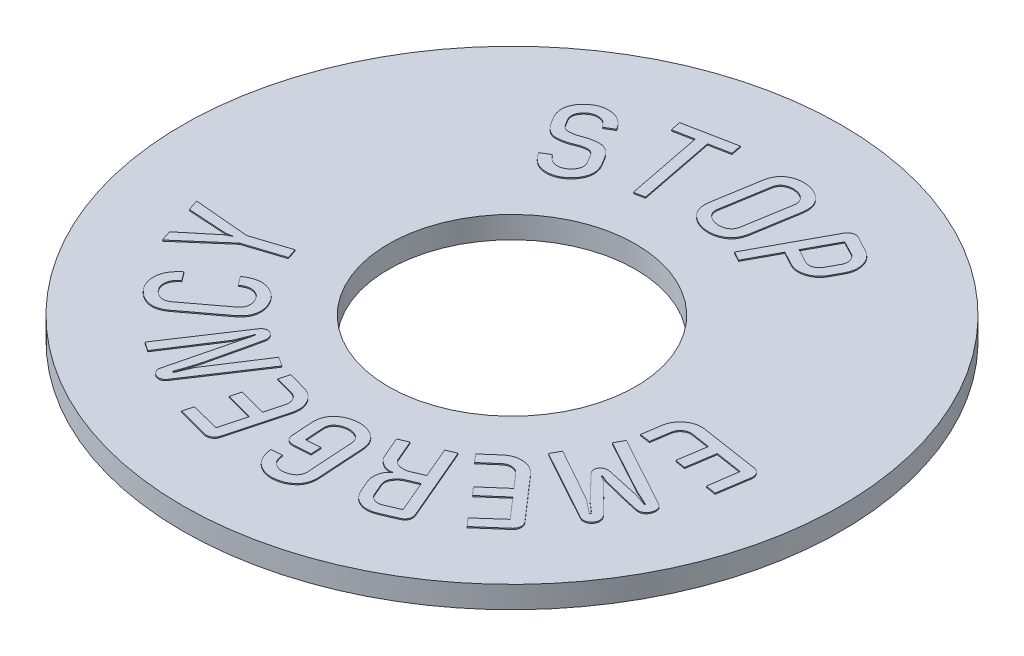
from build123d import *

# Parameters (mm, degrees)
SKETCH1_R           = 30
SKETCH1_R_2         = 11.25
BOSS_EXTRUDE1_DEPTH = 2
BOSS_EXTRUDE2_DEPTH = 0.1


with BuildPart() as part:
    # Sketch1 → Boss-Extrude1 (new body)
    with BuildSketch(Plane(origin=(0, 0, 0), x_dir=(1, 0, 0), z_dir=(0, 1, 0))):
        with Locations(Location((0, 0, 0), (0, 0, 270))):
            Circle(SKETCH1_R)
        with Locations(Location((0, 0, 0), (0, 0, 270))):
            Circle(SKETCH1_R_2, mode=Mode.SUBTRACT)
    extrude(amount=BOSS_EXTRUDE1_DEPTH)

    # Sketch3 → Boss-Extrude2 (add)
    # profile 1 of 13: a face of its own
    with BuildSketch(Plane(origin=(0, 2, 0), x_dir=(1, 0, 0), z_dir=(0, 1, 0))):
        with BuildLine():
            Line((23.360742002, -4.868812071), (23.80046509, -1.993762799))
            add(Edge.make_bspline(
                [(23.80046509, -1.993762799), (23.804162026, -1.944481383), (23.811490401, -1.846791638), (23.792650384, -1.70081306), (23.746172095, -1.561351396), (23.67556038, -1.430782013), (23.583336759, -1.312372436), (23.464878992, -1.219381231), (23.326899444, -1.149616805), (23.225419841, -1.125672964), (23.172736928, -1.113242571)],
                knots=[0, 0, 0, 0, 0.989267452, 1.961008668, 2.928604322, 3.92150966, 4.926237213, 5.915212748, 6.917687265, 8, 8, 8, 8], degree=3))
            Line((23.172736928, -1.113242571), (17.812657062, -0.292564763))
            add(Edge.make_bspline(
                [(17.812657062, -0.292564763), (17.74680703, -0.285968317), (17.618071331, -0.273072376), (17.426129639, -0.275816845), (17.240114892, -0.293056785), (17.05898389, -0.331111034), (16.882688347, -0.384661118), (16.710490848, -0.455187383), (16.544269486, -0.544920569), (16.384627892, -0.650051026), (16.233815464, -0.767333985), (16.099700271, -0.899956535), (15.977758132, -1.039965005), (15.874118393, -1.192905047), (15.781717051, -1.353846959), (15.709582815, -1.52810034), (15.647132108, -1.710703945), (15.621194621, -1.838270812), (15.60805247, -1.902907105)],
                knots=[0, 0, 0, 0, 1.051572874, 2.055807176, 3.047060603, 4.017826304, 4.993298972, 5.973576854, 6.971500116, 7.99192178, 9.010639383, 10.003564469, 10.986738304, 11.957951334, 12.936778027, 13.932125999, 14.952238045, 16, 16, 16, 16], degree=3))
            Line((15.60805247, -1.902907105), (15.342676304, -3.642492703))
            Line((15.342676304, -3.642492703), (16.293389808, -3.787899142))
            Line((16.293389808, -3.787899142), (16.559676299, -2.046833448))
            add(Edge.make_bspline(
                [(16.559676299, -2.046833448), (16.574236207, -1.983004134), (16.602781722, -1.857863187), (16.686582999, -1.685481977), (16.803472812, -1.537480158), (16.946124353, -1.413368765), (17.109376068, -1.317880454), (17.287149912, -1.257002908), (17.47507619, -1.227994323), (17.602024093, -1.238597816), (17.666880598, -1.244015042)],
                knots=[0, 0, 0, 0, 1.035449285, 2.030056384, 3.008390287, 4.006896508, 5.011359801, 5.986438677, 6.971290214, 8, 8, 8, 8], degree=3))
            Line((17.666880598, -1.244015042), (19.385407558, -1.506060989))
            Line((19.385407558, -1.506060989), (18.991233475, -4.083296392))
            Line((18.991233475, -4.083296392), (19.94194698, -4.228702832))
            Line((19.94194698, -4.228702832), (20.336121062, -1.651467429))
            Line((20.336121062, -1.651467429), (22.798812669, -2.028122663))
            Line((22.798812669, -2.028122663), (22.410028498, -4.723405631))
            Line((22.410028498, -4.723405631), (23.360742002, -4.868812071))
        make_face()
    # profile 2 of 13: a face of its own
    with BuildSketch(Plane(origin=(0, 2, 0), x_dir=(1, 0, 0), z_dir=(0, 1, 0))):
        with BuildLine():
            Line((17.349501254, -9.041782518), (16.829160357, -8.689619288))
            Line((16.829160357, -8.689619288), (16.862649191, -8.628702815))
            Line((16.862649191, -8.628702815), (17.418499319, -8.868175645))
            add(Edge.make_bspline(
                [(17.418499319, -8.868175645), (17.71964943, -8.943750905), (18.32159631, -9.094812752), (19.227364733, -9.32652173), (20.147753434, -9.549676012), (20.770885431, -9.681180668), (21.086436921, -9.747774087)],
                knots=[0, 0, 0, 0, 0.987684697, 1.974210543, 2.974148519, 4, 4, 4, 4], degree=3))
            add(Edge.make_bspline(
                [(21.086436921, -9.747774087), (21.128285633, -9.753042805), (21.209642242, -9.763285536), (21.331329867, -9.755667062), (21.448409785, -9.731199908), (21.558510568, -9.684814424), (21.660302295, -9.625286729), (21.750258337, -9.552458154), (21.8273051, -9.467552116), (21.867537779, -9.403077104), (21.887837447, -9.370545806)],
                knots=[0, 0, 0, 0, 1.069945797, 2.080043977, 3.08302623, 4.095916945, 5.102012342, 6.071443231, 7.026933797, 8, 8, 8, 8], degree=3))
            add(Edge.make_bspline(
                [(21.887837447, -9.370545806), (21.910013448, -9.327012592), (21.953909074, -9.240842066), (21.993259918, -9.100984742), (22.014006524, -8.956598995), (22.012958382, -8.809348802), (21.98607881, -8.663167762), (21.914187781, -8.531453982), (21.80926514, -8.413721034), (21.717994719, -8.355209325), (21.669883329, -8.32436604)],
                knots=[0, 0, 0, 0, 0.976803754, 1.93350518, 2.89471737, 3.891343824, 4.875181934, 5.836850555, 6.85973874, 8, 8, 8, 8], degree=3))
            Line((21.669883329, -8.32436604), (15.173174048, -4.751595078))
            Line((15.173174048, -4.751595078), (14.715493322, -5.584120212))
            Line((14.715493322, -5.584120212), (19.660890593, -8.27641024))
            Line((19.660890593, -8.27641024), (21.077173216, -8.922800068))
            Line((21.077173216, -8.922800068), (21.03810291, -8.993869287))
            Line((21.03810291, -8.993869287), (19.89190362, -8.601727063))
            Line((19.89190362, -8.601727063), (16.734602784, -7.923693611))
            add(Edge.make_bspline(
                [(16.734602784, -7.923693611), (16.696990086, -7.923776633), (16.624024541, -7.923937689), (16.516863579, -7.931896158), (16.417787871, -7.958827437), (16.325444043, -7.992785867), (16.243589778, -8.038384343), (16.171843022, -8.090475903), (16.111898952, -8.150617657), (16.082748913, -8.19746087), (16.068462501, -8.220418692)],
                knots=[0, 0, 0, 0, 1.178696214, 2.286573858, 3.352294177, 4.382929013, 5.362334893, 6.276182527, 7.155158415, 8, 8, 8, 8], degree=3))
            add(Edge.make_bspline(
                [(16.068462501, -8.220418692), (16.054025835, -8.250195334), (16.025425882, -8.309184753), (16.000784636, -8.404098475), (15.990409342, -8.501300508), (15.995532195, -8.599744672), (16.015788356, -8.696853226), (16.049930849, -8.790656057), (16.097980611, -8.880366868), (16.141821401, -8.933084404), (16.164026999, -8.959786122)],
                knots=[0, 0, 0, 0, 0.998124265, 1.977347596, 2.945436369, 3.943274761, 4.943683067, 5.932185595, 6.95264076, 8, 8, 8, 8], degree=3))
            add(Edge.make_bspline(
                [(16.164026999, -8.959786122), (16.33920729, -9.144496817), (16.699876076, -9.524787211), (17.253742939, -10.097094552), (17.815988096, -10.674485867), (18.185251154, -11.063498752), (18.367040159, -11.25501064)],
                knots=[0, 0, 0, 0, 0.960206654, 1.976915122, 3.004030925, 4, 4, 4, 4], degree=3))
            Line((18.367040159, -11.25501064), (19.33575387, -12.090456673))
            Line((19.33575387, -12.090456673), (19.263194731, -12.222442364))
            Line((19.263194731, -12.222442364), (17.980336965, -11.213104573))
            Line((17.980336965, -11.213104573), (13.25574922, -8.576098789))
            Line((13.25574922, -8.576098789), (13.108029311, -8.508110923))
            Line((13.108029311, -8.508110923), (12.650348585, -9.340636057))
            Line((12.650348585, -9.340636057), (19.168411214, -12.923941249))
            add(Edge.make_bspline(
                [(19.168411214, -12.923941249), (19.221331348, -12.946296577), (19.322860138, -12.989185911), (19.480666722, -13.011422102), (19.630427512, -13.00516519), (19.76790632, -12.960462796), (19.893292851, -12.896235764), (20.001089536, -12.811731812), (20.097004883, -12.716593621), (20.142910593, -12.63988088), (20.165999916, -12.60129646)],
                knots=[0, 0, 0, 0, 1.182308989, 2.268293556, 3.263025239, 4.252919619, 5.229046429, 6.159792407, 7.074425671, 8, 8, 8, 8], degree=3))
            add(Edge.make_bspline(
                [(20.165999916, -12.60129646), (20.181580701, -12.56929926), (20.212684314, -12.505423885), (20.240800085, -12.401030684), (20.254449178, -12.291548053), (20.251019382, -12.177265562), (20.229096467, -12.060510836), (20.186612865, -11.944543439), (20.123701945, -11.829928178), (20.067688313, -11.760519039), (20.038580586, -11.724450278)],
                knots=[0, 0, 0, 0, 0.902618981, 1.801880409, 2.731899368, 3.697973502, 4.695070111, 5.737260236, 6.824157418, 8, 8, 8, 8], degree=3))
            add(Edge.make_bspline(
                [(20.038580586, -11.724450278), (19.800582, -11.472921164), (19.317855049, -10.96275056), (18.820415696, -10.466912478), (18.568228575, -10.215537155)],
                knots=[0, 0, 0, 0, 0.986058829, 2, 2, 2, 2], degree=3))
            add(Edge.make_bspline(
                [(18.568228575, -10.215537155), (18.364608172, -10.017325587), (17.960454832, -9.623907906), (17.552019608, -9.234937515), (17.349501254, -9.041782518)],
                knots=[0, 0, 0, 0, 1.007639347, 2, 2, 2, 2], degree=3))
        make_face()
    # profile 3 of 13: a face of its own
    with BuildSketch(Plane(origin=(0, 2, 0), x_dir=(1, 0, 0), z_dir=(0, 1, 0))):
        with BuildLine():
            Line((14.699225393, -18.796223429), (16.890443621, -16.884455388))
            add(Edge.make_bspline(
                [(16.890443621, -16.884455388), (16.926072174, -16.849886151), (16.996441482, -16.78160908), (17.072713292, -16.655628631), (17.129957912, -16.520425177), (17.159085528, -16.37464262), (17.163995389, -16.224887849), (17.135043015, -16.077028089), (17.072287926, -15.935401264), (17.010832582, -15.851245822), (16.978954735, -15.807593079)],
                knots=[0, 0, 0, 0, 0.991620884, 1.958532373, 2.92829688, 3.923875178, 4.921469585, 5.914838079, 6.918393945, 8, 8, 8, 8], degree=3))
            Line((16.978954735, -15.807593079), (13.415699619, -11.721077803))
            add(Edge.make_bspline(
                [(13.415699619, -11.721077803), (13.369776335, -11.674038137), (13.279738393, -11.581811398), (13.131778361, -11.460239757), (12.977759946, -11.354354877), (12.815753064, -11.264359072), (12.645549891, -11.193034029), (12.469383947, -11.134572087), (12.284684868, -11.097221911), (12.095267621, -11.072910434), (11.903827666, -11.068744071), (11.715134768, -11.07955194), (11.532128827, -11.110142358), (11.353595304, -11.157747564), (11.179551773, -11.22244504), (11.011442071, -11.307821491), (10.847126714, -11.407973789), (10.745252733, -11.488216776), (10.693493292, -11.52898609)],
                knots=[0, 0, 0, 0, 1.045444074, 2.049714783, 3.041305798, 4.016491126, 4.992689633, 5.974180104, 6.964853515, 7.986263119, 9.009297387, 10.007248387, 10.989705289, 11.956092507, 12.943847875, 13.938107084, 14.952407429, 16, 16, 16, 16], degree=3))
            Line((10.693493292, -11.52898609), (9.367601376, -12.685256261))
            Line((9.367601376, -12.685256261), (9.999779652, -13.409842368))
            Line((9.999779652, -13.409842368), (11.326732523, -12.252118296))
            add(Edge.make_bspline(
                [(11.326732523, -12.252118296), (11.379161989, -12.212790255), (11.481991917, -12.135656156), (11.657573162, -12.060351667), (11.841520258, -12.01998719), (12.029958233, -12.020112578), (12.216069229, -12.050718001), (12.391540326, -12.117258177), (12.553247391, -12.217904333), (12.643839608, -12.307778197), (12.690288325, -12.353858597)],
                knots=[0, 0, 0, 0, 1.036709816, 2.033299272, 3.003670714, 4.005609757, 5.004090576, 5.980599581, 6.964606886, 8, 8, 8, 8], degree=3))
            Line((12.690288325, -12.353858597), (13.833604373, -13.662749044))
            Line((13.833604373, -13.662749044), (11.869364926, -15.376485335))
            Line((11.869364926, -15.376485335), (12.501543203, -16.101071442))
            Line((12.501543203, -16.101071442), (14.465782649, -14.387335151))
            Line((14.465782649, -14.387335151), (16.103352883, -16.264275067))
            Line((16.103352883, -16.264275067), (14.067047117, -18.071637322))
            Line((14.067047117, -18.071637322), (14.699225393, -18.796223429))
        make_face()
    # profile 4 of 13: a face of its own
    with BuildSketch(Plane(origin=(0, 2, 0), x_dir=(1, 0, 0), z_dir=(0, 1, 0))):
        with BuildLine():
            Line((11.405610111, -20.191861456), (8.519486307, -13.424649699))
            Line((8.519486307, -13.424649699), (7.65626717, -13.792800924))
            Line((7.65626717, -13.792800924), (8.85616746, -16.606255891))
            Line((8.85616746, -16.606255891), (7.769150768, -17.06985373))
            add(Edge.make_bspline(
                [(7.769150768, -17.06985373), (7.702445925, -17.093271725), (7.569537688, -17.139931672), (7.357400817, -17.169171352), (7.138942678, -17.164487374), (6.918617668, -17.131155234), (6.709201226, -17.063639444), (6.526204119, -16.958204405), (6.375843701, -16.815298356), (6.307595001, -16.697084204), (6.272882324, -16.636958081)],
                knots=[0, 0, 0, 0, 0.995015691, 1.982551438, 2.999373356, 4.068370397, 5.11514286, 6.082983089, 7.024966211, 8, 8, 8, 8], degree=3))
            Line((6.272882324, -16.636958081), (5.460919734, -14.729086757))
            Line((5.460919734, -14.729086757), (4.58704357, -15.101783059))
            Line((4.58704357, -15.101783059), (5.400612327, -17.009390782))
            add(Edge.make_bspline(
                [(5.400612327, -17.009390782), (5.433181602, -17.07439964), (5.500398652, -17.208566076), (5.649234053, -17.389808682), (5.835272497, -17.559453643), (6.014240071, -17.69060637), (6.17321894, -17.783995645), (6.300142591, -17.839086062), (6.429562681, -17.882011202), (6.563063443, -17.908209741), (6.700077923, -17.922451645), (6.840481343, -17.919649839), (6.984457288, -17.90554458), (7.07949585, -17.883715603), (7.127933094, -17.872590272)],
                knots=[0, 0, 0, 0, 1.248757034, 2.577206985, 4.007098047, 5.577644763, 6.38804345, 7.176493922, 7.955493042, 8.731097296, 9.51430453, 10.322644041, 11.145120702, 12, 12, 12, 12], degree=3))
            add(Edge.make_bspline(
                [(7.127933094, -17.872590272), (7.088176117, -17.89797136), (7.010263089, -17.947711496), (6.905254569, -18.036896178), (6.811637228, -18.133213297), (6.730362332, -18.23851891), (6.660740938, -18.351047095), (6.605812051, -18.473858548), (6.559876782, -18.603666489), (6.520278263, -18.784724545), (6.48939876, -19.005346999), (6.485703199, -19.256884674), (6.510008488, -19.487266706), (6.558166561, -19.626335843), (6.581371229, -19.693345441)],
                knots=[0, 0, 0, 0, 0.826063462, 1.618863188, 2.408751767, 3.17695492, 3.946531314, 4.722504653, 5.531187722, 6.355855609, 7.967305748, 9.427244191, 10.760333624, 12, 12, 12, 12], degree=3))
            Line((6.581371229, -19.693345441), (7.055175844, -20.800313972))
            add(Edge.make_bspline(
                [(7.055175844, -20.800313972), (7.08444337, -20.862794338), (7.141700026, -20.98502595), (7.24485018, -21.154514958), (7.357985221, -21.309476826), (7.483267186, -21.447686128), (7.619104569, -21.571763165), (7.76456457, -21.681042469), (7.922183646, -21.773967754), (8.089219236, -21.850287919), (8.26288659, -21.911498293), (8.441528198, -21.950721345), (8.622089018, -21.975004419), (8.805936312, -21.980427944), (8.992149783, -21.963930987), (9.181564253, -21.932691405), (9.372580948, -21.880049302), (9.498379387, -21.833058644), (9.562312932, -21.809176954)],
                knots=[0, 0, 0, 0, 1.095410878, 2.142974616, 3.146261397, 4.139440829, 5.100964843, 6.065149471, 7.024416431, 8.00167452, 8.978771279, 9.943691397, 10.901766133, 11.86986691, 12.858591887, 13.867167926, 14.916047628, 16, 16, 16, 16], degree=3))
            Line((9.562312932, -21.809176954), (11.012878468, -21.190655193))
            add(Edge.make_bspline(
                [(11.012878468, -21.190655193), (11.061888655, -21.1666916), (11.156009846, -21.120670924), (11.275979994, -21.024864837), (11.369067852, -20.911646612), (11.434189978, -20.783250195), (11.474064292, -20.64432676), (11.481726222, -20.496866646), (11.459393229, -20.343765296), (11.423470738, -20.244421631), (11.404863513, -20.192963342)],
                knots=[0, 0, 0, 0, 1.085606868, 2.084844364, 3.035395955, 3.987580068, 4.936889065, 5.897129465, 6.910749658, 8, 8, 8, 8], degree=3))
            Line((11.404863513, -20.192963342), (11.405610111, -20.191861456))
        make_face()
        with BuildLine():
            add(Edge.make_bspline(
                [(9.1862815, -20.924252455), (9.122848996, -20.946820911), (8.999902539, -20.990563655), (8.807980288, -21.012599516), (8.621783125, -20.994984697), (8.443534089, -20.942912125), (8.278924006, -20.857942589), (8.136256628, -20.740929378), (8.013174007, -20.598706303), (7.95662249, -20.485610395), (7.927657049, -20.427683161)],
                knots=[0, 0, 0, 0, 1.071983637, 2.077745371, 3.054122547, 4.039261738, 5.024723952, 5.988758296, 6.969850727, 8, 8, 8, 8], degree=3))
            Line((7.927657049, -20.427683161), (7.456364015, -19.319286926))
            add(Edge.make_bspline(
                [(7.456364015, -19.319286926), (7.436150979, -19.253452068), (7.396316377, -19.123708799), (7.397848418, -18.917896725), (7.441822503, -18.714084092), (7.534828004, -18.518908644), (7.656336618, -18.338337276), (7.800006315, -18.180231873), (7.962724101, -18.04944978), (8.084610267, -17.98633136), (8.145611167, -17.954742209)],
                knots=[0, 0, 0, 0, 0.983826069, 1.938863598, 2.916396067, 3.957823914, 5.021766433, 6.032883243, 7.015508515, 8, 8, 8, 8], degree=3))
            Line((8.145611167, -17.954742209), (9.233408839, -17.490789081))
            Line((9.233408839, -17.490789081), (10.465124667, -20.378843232))
            Line((10.465124667, -20.378843232), (9.1862815, -20.924252455))
        make_face(mode=Mode.SUBTRACT)
    # profile 5 of 13: a face of its own
    with BuildSketch(Plane(origin=(0, 2, 0), x_dir=(1, 0, 0), z_dir=(0, 1, 0))):
        with BuildLine():
            Line((1.818226219, -19.215805804), (0.500108088, -19.298678142))
            Line((0.500108088, -19.298678142), (0.390338587, -17.552749739))
            add(Edge.make_bspline(
                [(0.390338587, -17.552749739), (0.390595743, -17.513807691), (0.391095329, -17.438153777), (0.40726195, -17.327812891), (0.431946752, -17.22305529), (0.468225446, -17.123996866), (0.518116593, -17.033326823), (0.575546041, -16.947767186), (0.644544223, -16.868583923), (0.752304922, -16.773893936), (0.902501464, -16.67021331), (1.104493013, -16.581400351), (1.322316964, -16.515656496), (1.475351249, -16.501271273), (1.554074735, -16.493871265)],
                knots=[0, 0, 0, 0, 0.799187335, 1.552605829, 2.284997015, 3.007967986, 3.711720342, 4.405948712, 5.122049357, 5.861961628, 7.349161567, 8.84955465, 10.379356355, 12, 12, 12, 12], degree=3))
            add(Edge.make_bspline(
                [(1.554074735, -16.493871265), (1.633528677, -16.491994451), (1.788873542, -16.488324988), (2.016899089, -16.524194177), (2.230597236, -16.596401087), (2.397374502, -16.681111665), (2.52025905, -16.764320919), (2.601565953, -16.837465302), (2.671984039, -16.918307879), (2.73364561, -17.00663529), (2.784038627, -17.104076044), (2.821815396, -17.210370125), (2.851367748, -17.324221159), (2.861563583, -17.403528691), (2.866829153, -17.444486532)],
                knots=[0, 0, 0, 0, 1.58101885, 3.091138779, 4.569863131, 6.058696109, 6.8029877, 7.520482735, 8.230597278, 8.934751731, 9.661772023, 10.408474618, 11.178067438, 12, 12, 12, 12], degree=3))
            Line((2.866829153, -17.444486532), (3.13876097, -21.756222155))
            add(Edge.make_bspline(
                [(3.13876097, -21.756222155), (3.138225981, -21.796624227), (3.137184166, -21.875301533), (3.124108287, -21.990222444), (3.098868047, -22.097521156), (3.06331582, -22.19838974), (3.016321511, -22.29263373), (2.957562139, -22.379870106), (2.887262112, -22.459902579), (2.78071362, -22.557296838), (2.627684235, -22.658777899), (2.426288775, -22.751542281), (2.206913648, -22.815406863), (2.053547999, -22.831457568), (1.97489384, -22.839689233)],
                knots=[0, 0, 0, 0, 0.819105773, 1.595092334, 2.340085916, 3.049850285, 3.75943366, 4.469831141, 5.176694059, 5.914671909, 7.392062834, 8.877819893, 10.39877801, 12, 12, 12, 12], degree=3))
            add(Edge.make_bspline(
                [(1.97489384, -22.839689233), (1.896977959, -22.840539948), (1.743883898, -22.842211488), (1.518852653, -22.791223195), (1.308098393, -22.696442012), (1.144822953, -22.585494258), (1.025967762, -22.475741617), (0.944149891, -22.38153667), (0.876219211, -22.274213225), (0.814809158, -22.158123472), (0.765138667, -22.030235851), (0.725052461, -21.892210753), (0.694419343, -21.743641897), (0.683079659, -21.640507256), (0.677228554, -21.587291341)],
                knots=[0, 0, 0, 0, 1.386321899, 2.723933152, 4.076286709, 5.489307963, 6.22299165, 6.958299132, 7.707664743, 8.483551469, 9.298120133, 10.149907049, 11.045380017, 12, 12, 12, 12], degree=3))
            Line((0.677228554, -21.587291341), (-0.292513367, -21.64692419))
            add(Edge.make_bspline(
                [(-0.292513367, -21.64692419), (-0.282198344, -21.739069184), (-0.262207681, -21.91764751), (-0.205906711, -22.174172668), (-0.132175489, -22.411357151), (-0.042139179, -22.631034479), (0.067492177, -22.831387254), (0.193669357, -23.014176255), (0.338188271, -23.178275508), (0.501629044, -23.319355452), (0.674686771, -23.443237697), (0.853123696, -23.550717884), (1.037759617, -23.639147355), (1.227464789, -23.707055194), (1.421732961, -23.760255439), (1.621617822, -23.793864463), (1.827217168, -23.807076497), (1.965393002, -23.802617998), (2.035250365, -23.800363922)],
                knots=[0, 0, 0, 0, 1.25439028, 2.431026427, 3.548390851, 4.613282252, 5.639030896, 6.633708319, 7.614364075, 8.590017722, 9.549435708, 10.49261159, 11.406199913, 12.315550282, 13.21655549, 14.129391837, 15.054279248, 16, 16, 16, 16], degree=3))
            add(Edge.make_bspline(
                [(2.035250365, -23.800363922), (2.106332138, -23.794068919), (2.245792567, -23.781718301), (2.450813005, -23.746782574), (2.64693894, -23.6934842), (2.837075356, -23.62988917), (3.016706534, -23.546116764), (3.189130887, -23.450314199), (3.353654739, -23.339475274), (3.508872584, -23.21432574), (3.652582248, -23.076348568), (3.775866579, -22.920630229), (3.877935398, -22.750601755), (3.961292153, -22.567434042), (4.023365139, -22.36975185), (4.063893785, -22.157669638), (4.089077955, -21.932148019), (4.086842665, -21.777368821), (4.085695642, -21.69794497)],
                knots=[0, 0, 0, 0, 1.040060034, 2.040568389, 3.026643651, 4.000527954, 4.95930171, 5.91123233, 6.873805961, 7.8471449, 8.815013293, 9.771812088, 10.733074734, 11.699261578, 12.698973561, 13.745490792, 14.843114535, 16, 16, 16, 16], degree=3))
            Line((4.085695642, -21.69794497), (3.815728556, -17.383822199))
            add(Edge.make_bspline(
                [(3.815728556, -17.383822199), (3.806056297, -17.304321144), (3.787160992, -17.149011335), (3.734636938, -16.926368108), (3.66589167, -16.719467887), (3.57921398, -16.528440726), (3.470811873, -16.355370102), (3.346183705, -16.197666411), (3.202541873, -16.057283768), (3.040819604, -15.936308061), (2.868999631, -15.829395157), (2.689342641, -15.738722884), (2.503969033, -15.664871545), (2.313401418, -15.605983769), (2.116865675, -15.561240087), (1.913476797, -15.537657571), (1.705029333, -15.526595754), (1.564693536, -15.53209293), (1.49371821, -15.534873146)],
                knots=[0, 0, 0, 0, 1.155411881, 2.257162477, 3.295502504, 4.299034303, 5.277344073, 6.236166324, 7.194615157, 8.167588045, 9.145897814, 10.112831502, 11.068628266, 12.02299394, 12.989927628, 13.973578407, 14.975130116, 16, 16, 16, 16], degree=3))
            add(Edge.make_bspline(
                [(1.49371821, -15.534873146), (1.423132809, -15.540235839), (1.283962062, -15.550809273), (1.080364975, -15.589753775), (0.883775334, -15.638906656), (0.695310193, -15.704665965), (0.514747811, -15.785573879), (0.342131062, -15.881925348), (0.174815644, -15.990436615), (0.018477518, -16.115924104), (-0.126374876, -16.25367138), (-0.251915259, -16.407714067), (-0.355573733, -16.57615393), (-0.440783401, -16.757587159), (-0.503805648, -16.952639341), (-0.547498789, -17.161078267), (-0.571241508, -17.383007302), (-0.570513394, -17.535526694), (-0.570139628, -17.613820116)],
                knots=[0, 0, 0, 0, 1.035482593, 2.041624501, 3.029777764, 4.000022768, 4.959446084, 5.922524889, 6.891423792, 7.875232608, 8.853036292, 9.81259912, 10.775191329, 11.741427039, 12.740057205, 13.768567865, 14.85452954, 16, 16, 16, 16], degree=3))
            Line((-0.570139628, -17.613820116), (-0.445762356, -19.578701375))
            add(Edge.make_bspline(
                [(-0.445762356, -19.578701375), (-0.439429857, -19.630546266), (-0.427188939, -19.730764055), (-0.377435696, -19.870426111), (-0.304582889, -19.993232226), (-0.205342926, -20.093458654), (-0.089172673, -20.175835994), (0.045116068, -20.230345468), (0.193426874, -20.26217627), (0.296478734, -20.261485248), (0.350297377, -20.261124362)],
                knots=[0, 0, 0, 0, 1.06501534, 2.05870779, 3.007032648, 3.960436507, 4.920729162, 5.898865765, 6.902686528, 8, 8, 8, 8], degree=3))
            Line((0.350297377, -20.261124362), (1.877836147, -20.163925864))
            Line((1.877836147, -20.163925864), (1.818226219, -19.215805804))
        make_face()
    # profile 6 of 13: a face of its own
    with BuildSketch(Plane(origin=(0, 2, 0), x_dir=(1, 0, 0), z_dir=(0, 1, 0))):
        with BuildLine():
            Line((-7.397287467, -22.684494332), (-4.588402136, -23.436955054))
            add(Edge.make_bspline(
                [(-4.588402136, -23.436955054), (-4.539503785, -23.447040098), (-4.443369305, -23.466867359), (-4.296555334, -23.461580436), (-4.152523934, -23.433440336), (-4.015281651, -23.376163059), (-3.888284826, -23.296234285), (-3.78027519, -23.191061511), (-3.698614245, -23.059558148), (-3.663066375, -22.9617568), (-3.644707632, -22.911247168)],
                knots=[0, 0, 0, 0, 0.998041999, 1.962157123, 2.922682704, 3.927937283, 4.925918218, 5.916572105, 6.924011005, 8, 8, 8, 8], degree=3))
            Line((-3.644707632, -22.911247168), (-2.240765155, -17.673126318))
            add(Edge.make_bspline(
                [(-2.240765155, -17.673126318), (-2.227639647, -17.609207994), (-2.201734471, -17.483055503), (-2.18150134, -17.29302228), (-2.179533349, -17.105460511), (-2.196640013, -16.921362852), (-2.230203477, -16.739898929), (-2.282304539, -16.561770229), (-2.353595088, -16.387119342), (-2.440042949, -16.216855645), (-2.54187903, -16.055465643), (-2.65543115, -15.904804674), (-2.784144532, -15.771124295), (-2.922268496, -15.648659526), (-3.073473344, -15.541341121), (-3.237744881, -15.448719496), (-3.413546692, -15.369770897), (-3.537013584, -15.328744925), (-3.599440239, -15.308001597)],
                knots=[0, 0, 0, 0, 1.038325845, 2.049293275, 3.036854866, 4.019515377, 4.987936912, 5.970476597, 6.968323489, 7.986895657, 9.006322234, 10.002780058, 10.984473542, 11.955303124, 12.93780253, 13.929842157, 14.953298103, 16, 16, 16, 16], degree=3))
            Line((-3.599440239, -15.308001597), (-5.298791427, -14.850949585))
            Line((-5.298791427, -14.850949585), (-5.547613101, -15.779784176))
            Line((-5.547613101, -15.779784176), (-3.846614813, -16.235457602))
            add(Edge.make_bspline(
                [(-3.846614813, -16.235457602), (-3.785009145, -16.257727561), (-3.6642132, -16.301394335), (-3.502880816, -16.403706354), (-3.366883996, -16.534088399), (-3.26107291, -16.690180669), (-3.183229153, -16.862501785), (-3.140536468, -17.045847782), (-3.135298208, -17.236321011), (-3.15841499, -17.361490549), (-3.170238284, -17.42550968)],
                knots=[0, 0, 0, 0, 1.036327074, 2.032022574, 3.003446691, 4.003863017, 5.003494087, 5.985850586, 6.969844447, 8, 8, 8, 8], degree=3))
            Line((-3.170238284, -17.42550968), (-3.619277469, -19.102921376))
            Line((-3.619277469, -19.102921376), (-6.137202566, -18.428404792))
            Line((-6.137202566, -18.428404792), (-6.386024239, -19.357239384))
            Line((-6.386024239, -19.357239384), (-3.868099142, -20.031755968))
            Line((-3.868099142, -20.031755968), (-4.512637212, -22.437773283))
            Line((-4.512637212, -22.437773283), (-7.148465794, -21.75565974))
            Line((-7.148465794, -21.75565974), (-7.397287467, -22.684494332))
        make_face()
    # profile 7 of 13: a face of its own
    with BuildSketch(Plane(origin=(0, 2, 0), x_dir=(1, 0, 0), z_dir=(0, 1, 0))):
        with BuildLine():
            Line((-13.694153926, -19.451331185), (-10.6311356, -14.739098322))
            Line((-10.6311356, -14.739098322), (-10.067202242, -13.278095155))
            Line((-10.067202242, -13.278095155), (-10.009223042, -13.316466344))
            Line((-10.009223042, -13.316466344), (-11.740609163, -20.257859658))
            Line((-11.740609163, -20.257859658), (-11.737481967, -20.232138059))
            add(Edge.make_bspline(
                [(-11.737481967, -20.232138059), (-11.748255759, -20.267783724), (-11.769263848, -20.337290104), (-11.771299275, -20.447085724), (-11.752540971, -20.555714051), (-11.711980667, -20.662002648), (-11.654329046, -20.760570071), (-11.589606165, -20.852911803), (-11.512002959, -20.932028617), (-11.453386098, -20.97560645), (-11.424290806, -20.997236912)],
                knots=[0, 0, 0, 0, 1.003790086, 1.957315624, 2.939685071, 3.973694416, 5.016957811, 6.024626493, 7.01949596, 8, 8, 8, 8], degree=3))
            add(Edge.make_bspline(
                [(-11.424290806, -20.997236912), (-11.387633204, -21.019082189), (-11.31575282, -21.061917696), (-11.194951349, -21.096125325), (-11.070733826, -21.110381606), (-10.943308931, -21.099756094), (-10.816831615, -21.066289992), (-10.699914094, -20.998892714), (-10.592152982, -20.905745289), (-10.535227624, -20.825943899), (-10.505530371, -20.784312504)],
                knots=[0, 0, 0, 0, 0.966688811, 1.895540337, 2.828902563, 3.797844633, 4.787732983, 5.777784507, 6.840697765, 8, 8, 8, 8], degree=3))
            Line((-10.505530371, -20.784312504), (-6.386197545, -14.560884156))
            Line((-6.386197545, -14.560884156), (-7.207569557, -14.017292309))
            Line((-7.207569557, -14.017292309), (-10.251402288, -18.700535572))
            Line((-10.251402288, -18.700535572), (-10.806094863, -20.042593946))
            Line((-10.806094863, -20.042593946), (-10.941238859, -19.994841168))
            add(Edge.make_bspline(
                [(-10.941238859, -19.994841168), (-10.925193118, -19.94333275), (-10.888332763, -19.825007357), (-10.823937355, -19.627132415), (-10.738319402, -19.38817529), (-10.641387994, -19.116865493), (-10.540541646, -18.833064441), (-10.4474247, -18.55572492), (-10.368130904, -18.294723813), (-10.323933324, -18.124859353), (-10.302665385, -18.04312033)],
                knots=[0, 0, 0, 0, 0.630301841, 1.447932519, 2.43086737, 3.595620365, 4.813966911, 5.949550592, 7.013320786, 8, 8, 8, 8], degree=3))
            add(Edge.make_bspline(
                [(-10.302665385, -18.04312033), (-10.207929799, -17.629929987), (-10.018923268, -16.805575832), (-9.770956468, -15.780792009), (-9.574921579, -14.969534273), (-9.437775676, -14.372571992), (-9.307967794, -13.787013995), (-9.227558148, -13.399670876), (-9.187746244, -13.207892055)],
                knots=[0, 0, 0, 0, 1.537655605, 3.067769626, 3.824468825, 4.565035301, 5.289529553, 6, 6, 6, 6], degree=3))
            add(Edge.make_bspline(
                [(-9.187746244, -13.207892055), (-9.185243962, -13.172722972), (-9.180273918, -13.10286998), (-9.187456644, -12.997702996), (-9.216783591, -12.895771589), (-9.255999036, -12.796579025), (-9.30661803, -12.703547823), (-9.368680348, -12.623303682), (-9.432606367, -12.550793236), (-9.483225286, -12.513554492), (-9.50797114, -12.495349747)],
                knots=[0, 0, 0, 0, 1.03367766, 2.05309521, 3.070798676, 4.129888966, 5.178913687, 6.162254334, 7.101589169, 8, 8, 8, 8], degree=3))
            add(Edge.make_bspline(
                [(-9.50797114, -12.495349747), (-9.541869688, -12.474735797), (-9.608370817, -12.434295985), (-9.720638871, -12.401707789), (-9.836264466, -12.387640662), (-9.955477551, -12.39589367), (-10.074815636, -12.42911247), (-10.18816743, -12.494363173), (-10.294836166, -12.58773836), (-10.353837897, -12.666775138), (-10.384817321, -12.708274154)],
                knots=[0, 0, 0, 0, 0.938253505, 1.840636831, 2.749145332, 3.693571009, 4.659562116, 5.663537209, 6.773217845, 8, 8, 8, 8], degree=3))
            Line((-10.384817321, -12.708274154), (-14.496199538, -18.920529735))
            Line((-14.496199538, -18.920529735), (-13.694153926, -19.451331185))
        make_face()
    # profile 8 of 13: a face of its own
    with BuildSketch(Plane(origin=(0, 2, 0), x_dir=(1, 0, 0), z_dir=(0, 1, 0))):
        with BuildLine():
            add(Edge.make_bspline(
                [(-14.736563811, -10.180989003), (-14.693078611, -10.151147676), (-14.608527228, -10.093125052), (-14.476823841, -10.021388843), (-14.34712889, -9.961698359), (-14.218704181, -9.916409153), (-14.091802985, -9.885275124), (-13.966315408, -9.870567177), (-13.842506068, -9.867907262), (-13.682494497, -9.887184783), (-13.491634019, -9.934690484), (-13.282439557, -10.03351715), (-13.096083043, -10.169030866), (-12.997917605, -10.286032286), (-12.948180854, -10.345312524)],
                knots=[0, 0, 0, 0, 0.945101877, 1.837629111, 2.685202313, 3.502865876, 4.275768415, 5.02277245, 5.764379961, 6.490318181, 7.907261877, 9.269981263, 10.616801743, 12, 12, 12, 12], degree=3))
            add(Edge.make_bspline(
                [(-12.948180854, -10.345312524), (-12.904102268, -10.409438654), (-12.817997813, -10.534704592), (-12.727187944, -10.741549174), (-12.668577545, -10.955026031), (-12.650975868, -11.137912337), (-12.653848585, -11.283704415), (-12.671071474, -11.38950628), (-12.699941436, -11.491244108), (-12.74018242, -11.589613412), (-12.794771617, -11.683512911), (-12.860068598, -11.774288753), (-12.938042586, -11.860491166), (-12.996846933, -11.912883613), (-13.02697965, -11.939730724)],
                knots=[0, 0, 0, 0, 1.573970731, 3.074642434, 4.552706854, 6.043645665, 6.780156909, 7.502601233, 8.208885464, 8.919785686, 9.650263793, 10.40467, 11.182515738, 12, 12, 12, 12], degree=3))
            Line((-13.02697965, -11.939730724), (-16.47218229, -14.526801241))
            add(Edge.make_bspline(
                [(-16.47218229, -14.526801241), (-16.539334304, -14.569168011), (-16.667552957, -14.650062238), (-16.881895933, -14.715976855), (-17.097876055, -14.728685478), (-17.311122596, -14.685166049), (-17.514162143, -14.602350452), (-17.704935225, -14.487031771), (-17.877729298, -14.337369265), (-17.976167944, -14.218583082), (-18.026511799, -14.157833015)],
                knots=[0, 0, 0, 0, 1.065410529, 2.034272625, 2.984004733, 3.949323503, 4.938778606, 5.924879273, 6.938734129, 8, 8, 8, 8], degree=3))
            add(Edge.make_bspline(
                [(-18.026511799, -14.157833015), (-18.069534906, -14.093389848), (-18.154705351, -13.965815308), (-18.23292172, -13.749121789), (-18.269111157, -13.520428922), (-18.261240046, -13.323780231), (-18.233604863, -13.164033216), (-18.196007174, -13.045010688), (-18.145235233, -12.927950155), (-18.079658054, -12.813636409), (-17.997891163, -12.703001012), (-17.904089725, -12.593934746), (-17.795866661, -12.48735159), (-17.71576922, -12.42140767), (-17.67443207, -12.38737495)],
                knots=[0, 0, 0, 0, 1.377157514, 2.726281873, 4.067733145, 5.483309839, 6.212221035, 6.952750155, 7.702338071, 8.483312732, 9.296354982, 10.151115411, 11.045816953, 12, 12, 12, 12], degree=3))
            Line((-17.67443207, -12.38737495), (-18.265003901, -11.59873535))
            add(Edge.make_bspline(
                [(-18.265003901, -11.59873535), (-18.336409297, -11.659198394), (-18.474814013, -11.776393604), (-18.658347456, -11.967758288), (-18.816738142, -12.162225051), (-18.950166282, -12.360714625), (-19.059237459, -12.563557645), (-19.141804613, -12.771623833), (-19.197563762, -12.984536655), (-19.22708665, -13.199576597), (-19.23503511, -13.412935699), (-19.224699124, -13.622070456), (-19.198581835, -13.825364631), (-19.153084517, -14.022456052), (-19.088910223, -14.213328442), (-19.006132652, -14.397509614), (-18.907793429, -14.576990669), (-18.827974379, -14.688388869), (-18.787674641, -14.744632563)],
                knots=[0, 0, 0, 0, 1.260765719, 2.443735782, 3.568702851, 4.638655124, 5.663372736, 6.66797587, 7.649367216, 8.623296728, 9.588472362, 10.52386682, 11.443500147, 12.348227671, 13.246500308, 14.153828214, 15.067888705, 16, 16, 16, 16], degree=3))
            add(Edge.make_bspline(
                [(-18.787674641, -14.744632563), (-18.743975579, -14.800826613), (-18.658024235, -14.911354252), (-18.513409474, -15.060107834), (-18.364671379, -15.197305386), (-18.206251307, -15.318189344), (-18.040244847, -15.424768927), (-17.864261942, -15.513316066), (-17.681715364, -15.588856447), (-17.492693256, -15.650023579), (-17.298360517, -15.690670908), (-17.100773824, -15.707911189), (-16.901847953, -15.699439953), (-16.702324585, -15.664748278), (-16.502214754, -15.60744791), (-16.301206403, -15.525781059), (-16.098886146, -15.419836048), (-15.969131469, -15.332715391), (-15.902297435, -15.287841287)],
                knots=[0, 0, 0, 0, 1.036436485, 2.038558857, 3.018468549, 3.982621174, 4.938138908, 5.888612461, 6.848837207, 7.814535914, 8.77910107, 9.735277794, 10.696985993, 11.671535571, 12.679299101, 13.724145979, 14.827753213, 16, 16, 16, 16], degree=3))
            Line((-15.902297435, -15.287841287), (-12.45501873, -12.698635763))
            add(Edge.make_bspline(
                [(-12.45501873, -12.698635763), (-12.393689869, -12.647451077), (-12.274056569, -12.547605871), (-12.11672894, -12.382323408), (-11.980924753, -12.212463273), (-11.868924296, -12.03586852), (-11.783232097, -11.851846683), (-11.720492286, -11.662836288), (-11.681378708, -11.468022217), (-11.66733744, -11.269303056), (-11.673016306, -11.069592258), (-11.694404369, -10.872105314), (-11.733296203, -10.678012547), (-11.788998031, -10.4879436), (-11.860772877, -10.301413616), (-11.951656222, -10.119891794), (-12.053826952, -9.939086472), (-12.136658221, -9.825921661), (-12.178635161, -9.768572396)],
                knots=[0, 0, 0, 0, 1.160560654, 2.263888428, 3.310754723, 4.318420197, 5.296193925, 6.254566738, 7.207447595, 8.177085497, 9.144269306, 10.108821689, 11.061702547, 12.018179194, 12.985363002, 13.962832859, 14.967611598, 16, 16, 16, 16], degree=3))
            add(Edge.make_bspline(
                [(-12.178635161, -9.768572396), (-12.221250327, -9.714652104), (-12.305786805, -9.607689443), (-12.448849665, -9.462954612), (-12.604548508, -9.336444829), (-12.767202319, -9.219570561), (-12.944807747, -9.124112787), (-13.13098415, -9.038470117), (-13.329821655, -8.972631346), (-13.53678016, -8.920074452), (-13.751178081, -8.886817756), (-13.970246147, -8.882645651), (-14.191707562, -8.903204234), (-14.415706653, -8.948428086), (-14.641489289, -9.022275091), (-14.870512735, -9.120120615), (-15.102128524, -9.244340467), (-15.252002002, -9.343706829), (-15.328910448, -9.394697256)],
                knots=[0, 0, 0, 0, 0.930912967, 1.846668936, 2.750414574, 3.647567508, 4.556029005, 5.478026992, 6.421638082, 7.389642577, 8.369659997, 9.354464853, 10.35073478, 11.378543869, 12.444351051, 13.564088745, 14.749997983, 16, 16, 16, 16], degree=3))
            Line((-15.328910448, -9.394697256), (-14.736563811, -10.180989003))
        make_face()
    # profile 9 of 13: a face of its own
    with BuildSketch(Plane(origin=(0, 2, 0), x_dir=(1, 0, 0), z_dir=(0, 1, 0))):
        with BuildLine():
            Line((-23.25866655, -5.446166638), (-22.936401608, -6.437864423))
            add(Edge.make_bspline(
                [(-22.936401608, -6.437864423), (-22.885089052, -6.442557998), (-22.776317951, -6.452507324), (-22.603529853, -6.462910297), (-22.412498032, -6.47714125), (-22.202907873, -6.490363104), (-21.975384994, -6.503189597), (-21.729565103, -6.519011864), (-21.465763307, -6.533781373), (-21.189664046, -6.548426541), (-20.913009645, -6.56313882), (-20.647531349, -6.577899981), (-20.398917357, -6.593732637), (-20.167470239, -6.606361531), (-19.953501983, -6.620438562), (-19.75616489, -6.631735276), (-19.576197472, -6.643308756), (-19.461673861, -6.65174199), (-19.407470336, -6.655733403)],
                knots=[0, 0, 0, 0, 0.699467541, 1.482714153, 2.349740422, 3.300035104, 4.333628327, 5.443408881, 6.644072041, 7.920488063, 9.196904085, 10.405141879, 11.530067743, 12.578808832, 13.551818636, 14.441065666, 15.262163183, 16, 16, 16, 16], degree=3))
            add(Edge.make_bspline(
                [(-19.407470336, -6.655733403), (-19.387920682, -6.652869366), (-19.343816165, -6.646408026), (-19.270268768, -6.637441414), (-19.182267036, -6.620953757), (-19.084388083, -6.604123629), (-18.986768694, -6.585777463), (-18.900379892, -6.571913906), (-18.830795847, -6.557587149), (-18.789943838, -6.550055347), (-18.772050254, -6.546756344)],
                knots=[0, 0, 0, 0, 0.735436346, 1.659163133, 2.756911204, 4.066731388, 5.356075267, 6.453823338, 7.322759354, 8, 8, 8, 8], degree=3))
            Line((-18.772050254, -6.546756344), (-19.334112206, -6.838792267))
            add(Edge.make_bspline(
                [(-19.334112206, -6.838792267), (-19.379882073, -6.876033408), (-19.474606063, -6.953106594), (-19.619789522, -7.074494291), (-19.776377199, -7.20098141), (-19.94087718, -7.338588459), (-20.117805926, -7.481130516), (-20.305032518, -7.632441553), (-20.499998283, -7.79373633), (-20.70407682, -7.958231431), (-20.906124828, -8.125210153), (-21.103037606, -8.285805108), (-21.288358406, -8.440430925), (-21.465697319, -8.585859712), (-21.630452663, -8.727033826), (-21.787118098, -8.859168491), (-21.932410231, -8.985019692), (-22.026264463, -9.066092422), (-22.071540284, -9.105202373)],
                knots=[0, 0, 0, 0, 0.796920257, 1.64928305, 2.555800598, 3.515435774, 4.54569863, 5.624289667, 6.766598283, 7.963079561, 9.164336473, 10.306645088, 11.394806495, 12.424018202, 13.403978425, 14.324991199, 15.191966139, 16, 16, 16, 16], degree=3))
            Line((-22.071540284, -9.105202373), (-21.75476349, -10.074089635))
            add(Edge.make_bspline(
                [(-21.75476349, -10.074089635), (-21.66698593, -9.99982531), (-21.48568377, -9.846434369), (-21.20587358, -9.609474735), (-20.913012681, -9.354940852), (-20.606920968, -9.093477163), (-20.301281858, -8.827378392), (-20.005011539, -8.565207889), (-19.719981327, -8.314995615), (-19.53586291, -8.149720052), (-19.446031449, -8.069082028)],
                knots=[0, 0, 0, 0, 0.90240237, 1.863887538, 2.877702428, 3.947650536, 5.023337017, 6.058177578, 7.052583943, 8, 8, 8, 8], degree=3))
            add(Edge.make_bspline(
                [(-19.446031449, -8.069082028), (-19.201019773, -7.854105607), (-18.718935036, -7.43111821), (-18.233059137, -7.012491334), (-17.99412171, -6.806624715)],
                knots=[0, 0, 0, 0, 1.01646726, 2, 2, 2, 2], degree=3))
            Line((-17.99412171, -6.806624715), (-14.643119718, -5.716415336))
            Line((-14.643119718, -5.716415336), (-14.940319609, -4.801849601))
            Line((-14.940319609, -4.801849601), (-18.268016621, -5.883227516))
            Line((-18.268016621, -5.883227516), (-23.25866655, -5.446166638))
        make_face()
    # profile 10 of 13: a face of its own
    with BuildSketch(Plane(origin=(0, 2, 0), x_dir=(1, 0, 0), z_dir=(0, 1, 0))):
        with BuildLine():
            Line((-13.614004762, 17.40274894), (-13.265874142, 16.82784911))
            add(Edge.make_bspline(
                [(-13.265874142, 16.82784911), (-13.217180504, 16.755492659), (-13.123949006, 16.616955046), (-12.967552483, 16.43334189), (-12.810638683, 16.275837481), (-12.648983931, 16.146910659), (-12.483599795, 16.046321862), (-12.313774733, 15.974372777), (-12.139890051, 15.931389072), (-11.903368192, 15.916810577), (-11.605230766, 15.938361801), (-11.24496964, 15.996049129), (-10.881981064, 16.095685614), (-10.645793731, 16.190140718), (-10.525356525, 16.238305489)],
                knots=[0, 0, 0, 0, 1.000444075, 1.915504873, 2.763813574, 3.549322076, 4.283173205, 4.978995935, 5.658963681, 6.328132276, 7.690365879, 9.081493692, 10.511788332, 12, 12, 12, 12], degree=3))
            add(Edge.make_bspline(
                [(-10.525356525, 16.238305489), (-10.450827769, 16.268816273), (-10.305148859, 16.3284547), (-10.084650655, 16.401208728), (-9.865568668, 16.446001083), (-9.686257438, 16.473151), (-9.545250786, 16.477649923), (-9.444765431, 16.463744674), (-9.348423199, 16.436860213), (-9.257572408, 16.393712631), (-9.170038585, 16.338910351), (-9.088596166, 16.268010005), (-9.010768201, 16.184194836), (-8.965909685, 16.119333723), (-8.942674316, 16.085737606)],
                knots=[0, 0, 0, 0, 1.647300162, 3.219923504, 4.740110547, 6.216203301, 6.925054284, 7.617019886, 8.282805942, 8.9630578, 9.667099195, 10.388739757, 11.165415378, 12, 12, 12, 12], degree=3))
            Line((-8.942674316, 16.085737606), (-8.510302595, 15.372632075))
            add(Edge.make_bspline(
                [(-8.510302595, 15.372632075), (-8.477496429, 15.303543264), (-8.414554847, 15.170990162), (-8.372972917, 14.958679019), (-8.382218, 14.748665887), (-8.448052757, 14.547879949), (-8.548434229, 14.359419136), (-8.679932319, 14.188622451), (-8.836478001, 14.03494912), (-8.959092012, 13.952946028), (-9.021473112, 13.911226138)],
                knots=[0, 0, 0, 0, 1.062853833, 2.039180754, 2.983013283, 3.961327514, 4.958080094, 5.947529239, 6.955785054, 8, 8, 8, 8], degree=3))
            add(Edge.make_bspline(
                [(-9.021473112, 13.911226138), (-9.088401607, 13.874764991), (-9.220527141, 13.802785956), (-9.43960355, 13.746472152), (-9.665323365, 13.733523066), (-9.855623147, 13.756842297), (-10.00752318, 13.798444931), (-10.119437044, 13.845583798), (-10.227593988, 13.906880088), (-10.332509735, 13.981105342), (-10.432800562, 14.070742463), (-10.530082662, 14.17355895), (-10.624906383, 14.289710835), (-10.681984351, 14.375124608), (-10.71145581, 14.41922689)],
                knots=[0, 0, 0, 0, 1.383392256, 2.730995832, 4.076600337, 5.481308226, 6.199730753, 6.938614725, 7.685789673, 8.459380443, 9.273976861, 10.130456982, 11.034685978, 12, 12, 12, 12], degree=3))
            Line((-10.71145581, 14.41922689), (-11.513216536, 13.933525831))
            add(Edge.make_bspline(
                [(-11.513216536, 13.933525831), (-11.463562459, 13.856973456), (-11.366717747, 13.707666628), (-11.203293165, 13.505310798), (-11.034123528, 13.326112428), (-10.8569386, 13.172600379), (-10.673988476, 13.042202231), (-10.483358701, 12.937265944), (-10.285116153, 12.857556653), (-10.081071031, 12.803140819), (-9.875946055, 12.769872606), (-9.672742553, 12.756499698), (-9.472262734, 12.760926465), (-9.274642634, 12.786391412), (-9.079996679, 12.830630819), (-8.888278959, 12.892537203), (-8.699717484, 12.974907376), (-8.579401321, 13.043335294), (-8.518502071, 13.07797078)],
                knots=[0, 0, 0, 0, 1.251225435, 2.44037499, 3.5630678, 4.628498209, 5.651816878, 6.640149135, 7.606979282, 8.576087292, 9.531631275, 10.453827084, 11.366602348, 12.278700994, 13.182770787, 14.101805155, 15.03920936, 16, 16, 16, 16], degree=3))
            add(Edge.make_bspline(
                [(-8.518502071, 13.07797078), (-8.460849506, 13.114472903), (-8.346971116, 13.186573822), (-8.189204439, 13.309958689), (-8.044183341, 13.442498815), (-7.913127985, 13.586151094), (-7.792941317, 13.738845447), (-7.687958912, 13.903363558), (-7.59542635, 14.077367467), (-7.514693404, 14.258649191), (-7.451411043, 14.447259936), (-7.414809367, 14.641855657), (-7.401408008, 14.839358664), (-7.41110819, 15.039878207), (-7.447911476, 15.243198919), (-7.506881495, 15.44924836), (-7.589196531, 15.659164158), (-7.661470677, 15.794693728), (-7.698659274, 15.864430348)],
                knots=[0, 0, 0, 0, 1.007654322, 1.990371995, 2.954600348, 3.90716221, 4.860189182, 5.822152256, 6.786274543, 7.769685736, 8.75146638, 9.718236826, 10.686557487, 11.670384558, 12.676278192, 13.732201737, 14.833106405, 16, 16, 16, 16], degree=3))
            Line((-7.698659274, 15.864430348), (-8.129675331, 16.578485499))
            add(Edge.make_bspline(
                [(-8.129675331, 16.578485499), (-8.177193502, 16.645844195), (-8.268827063, 16.775738023), (-8.418807316, 16.951164866), (-8.572190619, 17.101135012), (-8.731625749, 17.224982652), (-8.898088716, 17.318837757), (-9.06932949, 17.387389585), (-9.245771866, 17.428794277), (-9.486474993, 17.442931389), (-9.788395928, 17.42578942), (-10.148077378, 17.372020506), (-10.504534618, 17.284575946), (-10.733516189, 17.196454107), (-10.848934562, 17.152036213)],
                knots=[0, 0, 0, 0, 0.962404451, 1.855891001, 2.691419397, 3.46429927, 4.206728018, 4.915811546, 5.612498983, 6.312876576, 7.724297873, 9.136684822, 10.556743347, 12, 12, 12, 12], degree=3))
            add(Edge.make_bspline(
                [(-10.848934562, 17.152036213), (-10.92061712, 17.125624969), (-11.063308947, 17.073050552), (-11.28473835, 17.016683642), (-11.509450925, 16.977207369), (-11.698418444, 16.954775075), (-11.847905899, 16.95375026), (-11.954500294, 16.964911305), (-12.055043653, 16.990302137), (-12.149223703, 17.029767582), (-12.238980766, 17.079197414), (-12.320239264, 17.14506509), (-12.396545616, 17.222491124), (-12.440712721, 17.282212895), (-12.463471603, 17.312986946)],
                knots=[0, 0, 0, 0, 1.559181381, 3.103717903, 4.657292656, 6.217559557, 6.982179836, 7.705575624, 8.400317883, 9.091206439, 9.786229838, 10.484897754, 11.219282461, 12, 12, 12, 12], degree=3))
            Line((-12.463471603, 17.312986946), (-12.811127414, 17.888931358))
            add(Edge.make_bspline(
                [(-12.811127414, 17.888931358), (-12.844843038, 17.956711567), (-12.909899965, 18.087498769), (-12.953164225, 18.299136946), (-12.942842219, 18.508900001), (-12.879845385, 18.710353043), (-12.778681501, 18.898356411), (-12.647467297, 19.06986296), (-12.488376068, 19.223341489), (-12.364302592, 19.306044188), (-12.3008443, 19.348343093)],
                knots=[0, 0, 0, 0, 1.050463566, 2.026951402, 2.969470295, 3.944158953, 4.939524242, 5.927596262, 6.94005385, 8, 8, 8, 8], degree=3))
            add(Edge.make_bspline(
                [(-12.3008443, 19.348343093), (-12.234392634, 19.38357223), (-12.103437027, 19.452997923), (-11.886542249, 19.507936512), (-11.661326554, 19.52161887), (-11.470152093, 19.495725289), (-11.317307141, 19.454421458), (-11.203824771, 19.40893964), (-11.094770253, 19.347629248), (-10.988886831, 19.273875801), (-10.887867971, 19.186064215), (-10.791842707, 19.083612758), (-10.697776519, 18.968882056), (-10.641426068, 18.883905385), (-10.612538172, 18.840342341)],
                knots=[0, 0, 0, 0, 1.370034182, 2.699912091, 4.050133259, 5.471078128, 6.201804241, 6.939346446, 7.698000378, 8.482594032, 9.293261868, 10.138245746, 11.04557708, 12, 12, 12, 12], degree=3))
            Line((-10.612538172, 18.840342341), (-9.798301407, 19.334039854))
            add(Edge.make_bspline(
                [(-9.798301407, 19.334039854), (-9.849507339, 19.408939087), (-9.949355569, 19.554987707), (-10.113816871, 19.754086677), (-10.283981878, 19.930470839), (-10.461205228, 20.083042405), (-10.649582758, 20.206929612), (-10.842340357, 20.310760862), (-11.043344034, 20.388815586), (-11.249981771, 20.439182241), (-11.457031094, 20.471626393), (-11.661956324, 20.482529918), (-11.86276493, 20.478148215), (-12.059569935, 20.455287757), (-12.25116933, 20.41057542), (-12.438723131, 20.350039673), (-12.622606099, 20.27136041), (-12.739571402, 20.205089159), (-12.798785631, 20.17153903)],
                knots=[0, 0, 0, 0, 1.250122672, 2.437657689, 3.554425474, 4.625601475, 5.653264937, 6.656057527, 7.638856508, 8.615993685, 9.582352667, 10.523702496, 11.440687937, 12.348404913, 13.249132657, 14.148046843, 15.062440094, 16, 16, 16, 16], degree=3))
            add(Edge.make_bspline(
                [(-12.798785631, 20.17153903), (-12.857452229, 20.133783139), (-12.9730945, 20.059359582), (-13.134879367, 19.935286544), (-13.280764811, 19.799643609), (-13.416010194, 19.657828092), (-13.535709489, 19.50456715), (-13.638995859, 19.340602133), (-13.732557397, 19.169618199), (-13.809227903, 18.988978249), (-13.868979377, 18.801907997), (-13.903933641, 18.609835093), (-13.916634301, 18.414978791), (-13.901433087, 18.217061586), (-13.866650676, 18.015729742), (-13.807426196, 17.811505168), (-13.721989925, 17.605821892), (-13.651549113, 17.47117976), (-13.615275288, 17.401845164)],
                knots=[0, 0, 0, 0, 1.034619687, 2.039418903, 3.019182923, 3.986807929, 4.943613163, 5.897937341, 6.858577338, 7.831690702, 8.80441559, 9.765341683, 10.720421647, 11.692581203, 12.702462689, 13.746635914, 14.839619613, 16, 16, 16, 16], degree=3))
            Line((-13.615275288, 17.401845164), (-13.614004762, 17.40274894))
        make_face()
    # profile 11 of 13: a face of its own
    with BuildSketch(Plane(origin=(0, 2, 0), x_dir=(1, 0, 0), z_dir=(0, 1, 0))):
        Polygon((-7.459782522, 22.725132131), (-7.274559179, 21.781349214), (-5.455218616, 22.13840626), (-4.078317381, 15.122574215), (-3.145905343, 15.305565951), (-4.522806578, 22.321397996), (-2.657982501, 22.687381469), (-2.843205844, 23.631164386), align=None)
    # profile 12 of 13: a face of its own
    with BuildSketch(Plane(origin=(0, 2, 0), x_dir=(1, 0, 0), z_dir=(0, 1, 0))):
        with BuildLine():
            add(Edge.make_bspline(
                [(0.173664817, 17.773678255), (0.164790194, 17.694401445), (0.147517302, 17.540103092), (0.147699822, 17.313048157), (0.169752137, 17.098056117), (0.210559095, 16.894643528), (0.274942973, 16.703228033), (0.360933244, 16.524024979), (0.469216945, 16.357274687), (0.596843595, 16.203590562), (0.739672233, 16.063614685), (0.891885999, 15.93590347), (1.054215015, 15.822908865), (1.225058379, 15.723763387), (1.405520697, 15.639982026), (1.594364296, 15.569374521), (1.792526042, 15.511239297), (1.929640649, 15.486096558), (1.999213929, 15.473338889)],
                knots=[0, 0, 0, 0, 1.162811782, 2.263208389, 3.303805537, 4.310918308, 5.282676818, 6.241495405, 7.202390559, 8.17507164, 9.149151994, 10.115562843, 11.069797079, 12.030277279, 12.9929685, 13.967969228, 14.968927896, 16, 16, 16, 16], degree=3))
            add(Edge.make_bspline(
                [(1.999213929, 15.473338889), (2.068950886, 15.463171213), (2.206834614, 15.443067713), (2.413791287, 15.434561034), (2.616920084, 15.437569532), (2.81551827, 15.463369452), (3.010870215, 15.498043796), (3.200888351, 15.555264007), (3.387873167, 15.62546166), (3.569359641, 15.711428115), (3.741260567, 15.814990802), (3.898163565, 15.937904528), (4.038341138, 16.079931949), (4.161450781, 16.240546144), (4.267075178, 16.419286666), (4.356184554, 16.616198117), (4.43039685, 16.830521926), (4.464662921, 16.981858384), (4.482214302, 17.059374238)],
                knots=[0, 0, 0, 0, 1.024510439, 2.025659333, 3.009662004, 3.975701346, 4.935563463, 5.892598293, 6.857439605, 7.839256908, 8.809665019, 9.770834523, 10.730868767, 11.704879933, 12.7073483, 13.744171004, 14.844544698, 16, 16, 16, 16], degree=3))
            Line((4.482214302, 17.059374238), (5.18868068, 21.323456957))
            add(Edge.make_bspline(
                [(5.18868068, 21.323456957), (5.19650532, 21.401981978), (5.211703193, 21.554501889), (5.211941482, 21.779465871), (5.190889501, 21.992582539), (5.14689237, 22.194533438), (5.081593477, 22.385004895), (4.993988877, 22.56337377), (4.885186919, 22.729922784), (4.756145678, 22.882831602), (4.612351063, 23.022366483), (4.458850833, 23.149344296), (4.295759998, 23.261343637), (4.124368633, 23.361470923), (3.942488115, 23.444730005), (3.752483142, 23.515083495), (3.553876211, 23.573547366), (3.41675364, 23.598665267), (3.347176319, 23.611410334)],
                knots=[0, 0, 0, 0, 1.151616805, 2.236796479, 3.278435322, 4.272290394, 5.247653051, 6.21099705, 7.166012271, 8.144883745, 9.125759469, 10.087927942, 11.049819611, 12.011261305, 12.982314382, 13.965935052, 14.967895736, 16, 16, 16, 16], degree=3))
            add(Edge.make_bspline(
                [(3.347176319, 23.611410334), (3.277432088, 23.621311447), (3.139504773, 23.640892048), (2.933165861, 23.653226303), (2.731298359, 23.645846388), (2.533547148, 23.623701999), (2.338900786, 23.588147013), (2.149313491, 23.53149966), (1.963459289, 23.461007679), (1.78355913, 23.374367701), (1.611947658, 23.27267177), (1.458855952, 23.147180451), (1.317182245, 23.008920886), (1.197641419, 22.847031882), (1.090447684, 22.671136976), (1.004229621, 22.474755474), (0.928877169, 22.262939097), (0.896061176, 22.112455774), (0.879265077, 22.035434405)],
                knots=[0, 0, 0, 0, 1.030311359, 2.037560346, 3.019199679, 3.981653373, 4.946950363, 5.909404056, 6.872066081, 7.852069802, 8.827972499, 9.781775375, 10.741447002, 11.716013151, 12.717138178, 13.74900541, 14.847881055, 16, 16, 16, 16], degree=3))
            Line((0.879265077, 22.035434405), (0.173664817, 17.773678255))
        make_face()
        with BuildLine():
            add(Edge.make_bspline(
                [(1.805453831, 21.883693347), (1.814491142, 21.922198133), (1.832098493, 21.997216829), (1.871078418, 22.103867911), (1.919589906, 22.201083334), (1.977148131, 22.289751127), (2.044803739, 22.369166508), (2.122627167, 22.439966315), (2.209752754, 22.502162921), (2.338358045, 22.570729387), (2.510497698, 22.636866033), (2.729278142, 22.679157668), (2.957756019, 22.69328175), (3.110914596, 22.672926396), (3.189578726, 22.662471636)],
                knots=[0, 0, 0, 0, 0.80320807, 1.564886522, 2.301339367, 3.006934532, 3.707852883, 4.415273653, 5.140075263, 5.876965821, 7.372379825, 8.866887923, 10.390795073, 12, 12, 12, 12], degree=3))
            add(Edge.make_bspline(
                [(3.189578726, 22.662471636), (3.266846873, 22.647080595), (3.418055742, 22.616961301), (3.629190948, 22.530281039), (3.821686767, 22.419736261), (3.962545819, 22.302291282), (4.05876522, 22.19470954), (4.121853052, 22.109771203), (4.170514897, 22.017143956), (4.209512501, 21.920833373), (4.234903624, 21.818051956), (4.247303122, 21.710024995), (4.252099651, 21.596476163), (4.243487209, 21.519564765), (4.239111632, 21.48048969)],
                knots=[0, 0, 0, 0, 1.603965082, 3.13885808, 4.630808487, 6.119750179, 6.854467135, 7.572814248, 8.271625187, 8.98297185, 9.688078511, 10.423414399, 11.199010777, 12, 12, 12, 12], degree=3))
            Line((4.239111632, 21.48048969), (3.534032025, 17.217227246))
            add(Edge.make_bspline(
                [(3.534032025, 17.217227246), (3.5244605, 17.177804522), (3.505915307, 17.1014215), (3.466545638, 16.993135422), (3.420235551, 16.892555062), (3.361089017, 16.802527887), (3.29385685, 16.721221206), (3.217141072, 16.649780033), (3.130917094, 16.587430751), (3.004153157, 16.516857278), (2.832728184, 16.452348889), (2.615770829, 16.406091436), (2.388104362, 16.393767132), (2.234912867, 16.412650376), (2.156811522, 16.422277586)],
                knots=[0, 0, 0, 0, 0.821979935, 1.592617256, 2.332654687, 3.061854895, 3.769880679, 4.467400368, 5.181385918, 5.92211708, 7.40362274, 8.874909049, 10.40674049, 12, 12, 12, 12], degree=3))
            add(Edge.make_bspline(
                [(2.156811522, 16.422277586), (2.079636866, 16.438496289), (1.928223156, 16.47031676), (1.715277397, 16.555135297), (1.523049582, 16.669583935), (1.379818195, 16.785902615), (1.280198497, 16.892969003), (1.218382091, 16.980686602), (1.166950702, 17.073019106), (1.130625316, 17.172299576), (1.102645876, 17.275939319), (1.090909068, 17.385956493), (1.085919776, 17.50110334), (1.094484548, 17.579150893), (1.098895765, 17.619348664)],
                knots=[0, 0, 0, 0, 1.590201268, 3.11991383, 4.602362192, 6.093461134, 6.828257958, 7.548438772, 8.255413961, 8.95542014, 9.677984058, 10.417014563, 11.184695961, 12, 12, 12, 12], degree=3))
            Line((1.098895765, 17.619348664), (1.805453831, 21.883693347))
        make_face(mode=Mode.SUBTRACT)
    # profile 13 of 13: a face of its own
    with BuildSketch(Plane(origin=(0, 2, 0), x_dir=(1, 0, 0), z_dir=(0, 1, 0))):
        with BuildLine():
            add(Edge.make_bspline(
                [(9.736476487, 21.801806279), (9.692462107, 21.82170546), (9.60576098, 21.860903592), (9.465637775, 21.886413982), (9.323676256, 21.8888522), (9.181680207, 21.862899392), (9.043566997, 21.813071435), (8.921189931, 21.728711357), (8.810791551, 21.622114003), (8.754700145, 21.534153708), (8.72568152, 21.488647864)],
                knots=[0, 0, 0, 0, 0.985535357, 1.941343413, 2.890969389, 3.878433026, 4.881349837, 5.871328634, 6.898741881, 8, 8, 8, 8], degree=3))
            Line((8.72568152, 21.488647864), (5.238415635, 15.012057424))
            Line((5.238415635, 15.012057424), (6.064766603, 14.567119614))
            Line((6.064766603, 14.567119614), (7.536906518, 17.301219111))
            Line((7.536906518, 17.301219111), (8.791735764, 16.625572806))
            add(Edge.make_bspline(
                [(8.791735764, 16.625572806), (8.849684873, 16.597900253), (8.964124824, 16.543251514), (9.142721693, 16.482798124), (9.322816446, 16.443257836), (9.502850506, 16.418851999), (9.684340264, 16.414023366), (9.866882508, 16.427466846), (10.050454282, 16.459700757), (10.232349663, 16.509706199), (10.408336239, 16.57709398), (10.577530965, 16.65534979), (10.735682881, 16.749345499), (10.881405083, 16.858877533), (11.016686894, 16.981098236), (11.143223494, 17.115035978), (11.257684667, 17.264641061), (11.323126387, 17.373131638), (11.356220065, 17.427994992)],
                knots=[0, 0, 0, 0, 1.03802618, 2.049930845, 3.041155162, 4.016591996, 4.984165159, 5.972086762, 6.972214777, 7.994122832, 9.018227297, 10.017006411, 11.006043912, 11.987701362, 12.960580027, 13.951804344, 14.96423372, 16, 16, 16, 16], degree=3))
            Line((11.356220065, 17.427994992), (11.905591495, 18.449392955))
            add(Edge.make_bspline(
                [(11.905591495, 18.449392955), (11.932527914, 18.506955203), (11.986073983, 18.621381407), (12.047109405, 18.798890982), (12.093551453, 18.977490873), (12.120682065, 19.157893867), (12.12791215, 19.33981127), (12.122245525, 19.523365601), (12.096577758, 19.708687031), (12.052665554, 19.892915773), (11.995361171, 20.073010789), (11.920762277, 20.243507624), (11.832277873, 20.40355832), (11.726895122, 20.551277982), (11.609839546, 20.690731613), (11.47404263, 20.815383935), (11.326823184, 20.933047004), (11.218408888, 20.99910972), (11.1634145, 21.032620786)],
                knots=[0, 0, 0, 0, 1.027200848, 2.041940632, 3.030583903, 4.008426544, 4.985600632, 5.97143055, 6.974836627, 8.005234188, 9.031341719, 10.027065636, 11.010281881, 11.983225123, 12.957678497, 13.948797506, 14.959504127, 16, 16, 16, 16], degree=3))
            Line((11.1634145, 21.032620786), (9.736476487, 21.801806279))
        make_face()
        with BuildLine():
            Line((9.442998124, 20.841265847), (10.708813489, 20.18602327))
            add(Edge.make_bspline(
                [(10.708813489, 20.18602327), (10.761905517, 20.151695978), (10.865266479, 20.084866699), (10.991860284, 19.951472696), (11.089667556, 19.798077333), (11.153439204, 19.625278454), (11.187651807, 19.443689706), (11.186179709, 19.258540369), (11.146974688, 19.073808938), (11.094700508, 18.957888998), (11.067850002, 18.898347002)],
                knots=[0, 0, 0, 0, 1.022916088, 1.991440073, 2.957583345, 3.956416928, 4.96144826, 5.940949764, 6.942373827, 8, 8, 8, 8], degree=3))
            Line((11.067850002, 18.898347002), (10.519732725, 17.879637445))
            add(Edge.make_bspline(
                [(10.519732725, 17.879637445), (10.484092939, 17.823847281), (10.414777203, 17.715341125), (10.281873787, 17.578367968), (10.127891916, 17.474491184), (9.958228419, 17.402537915), (9.779473179, 17.363191428), (9.598292626, 17.362110414), (9.417444875, 17.395139747), (9.304935316, 17.445629393), (9.247094833, 17.471585815)],
                knots=[0, 0, 0, 0, 1.070233006, 2.081493625, 3.065534921, 4.059062069, 5.049616556, 6.009042384, 6.976460732, 8, 8, 8, 8], degree=3))
            Line((9.247094833, 17.471585815), (7.992830447, 18.147973805))
            Line((7.992830447, 18.147973805), (9.442998124, 20.841265847))
        make_face(mode=Mode.SUBTRACT)
    extrude(amount=BOSS_EXTRUDE2_DEPTH)


solid = part.part
